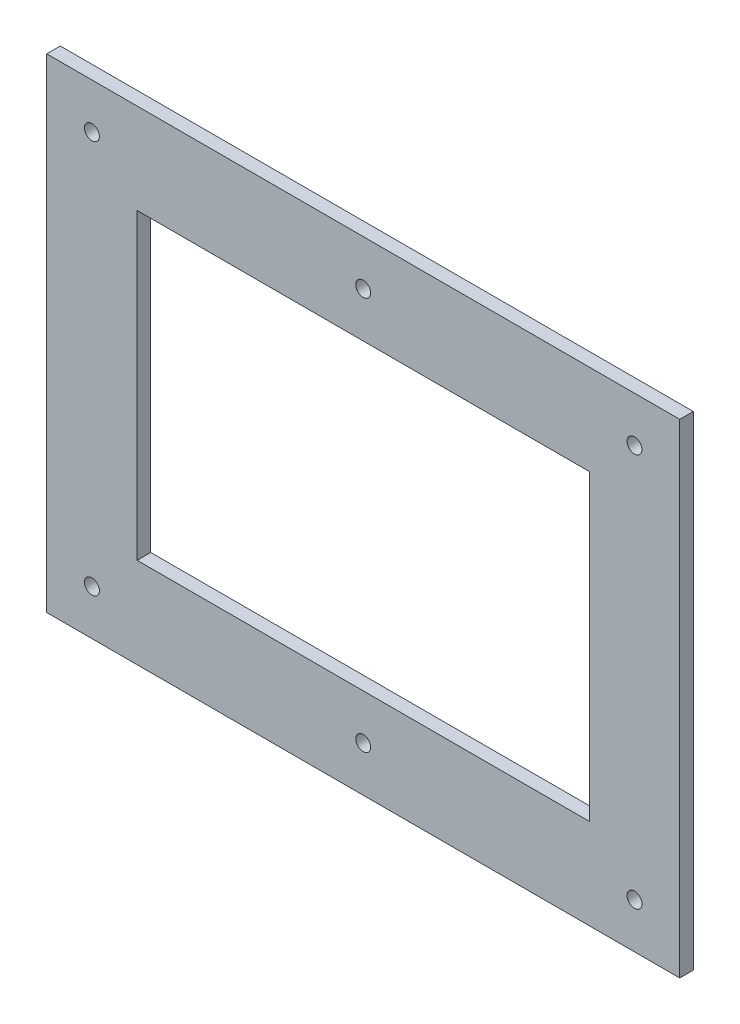
from build123d import *

# Parameters (mm, degrees)
ESQUISSE1_W        = 140
ESQUISSE1_H        = 107
ESQUISSE1_R        = 1.65
ESQUISSE1_W_2      = 100
ESQUISSE1_H_2      = 67
BOSS_EXTRU_1_DEPTH = 3


with BuildPart() as part:
    # Esquisse1 → Boss.-Extru.1 (new body)
    with BuildSketch(Plane.XY):
        with Locations((50, 33.5)):
            Rectangle(ESQUISSE1_W, ESQUISSE1_H)
        with Locations((110, 77)):
            Circle(ESQUISSE1_R, mode=Mode.SUBTRACT)
        with Locations((-10, 77)):
            Circle(ESQUISSE1_R, mode=Mode.SUBTRACT)
        with Locations((-10, -10)):
            Circle(ESQUISSE1_R, mode=Mode.SUBTRACT)
        with Locations((110, -10)):
            Circle(ESQUISSE1_R, mode=Mode.SUBTRACT)
        with Locations((50, 77)):
            Circle(ESQUISSE1_R, mode=Mode.SUBTRACT)
        with Locations((50, -10)):
            Circle(ESQUISSE1_R, mode=Mode.SUBTRACT)
        with Locations((50, 33.5)):
            Rectangle(ESQUISSE1_W_2, ESQUISSE1_H_2, mode=Mode.SUBTRACT)
    extrude(amount=BOSS_EXTRU_1_DEPTH)


solid = part.part
